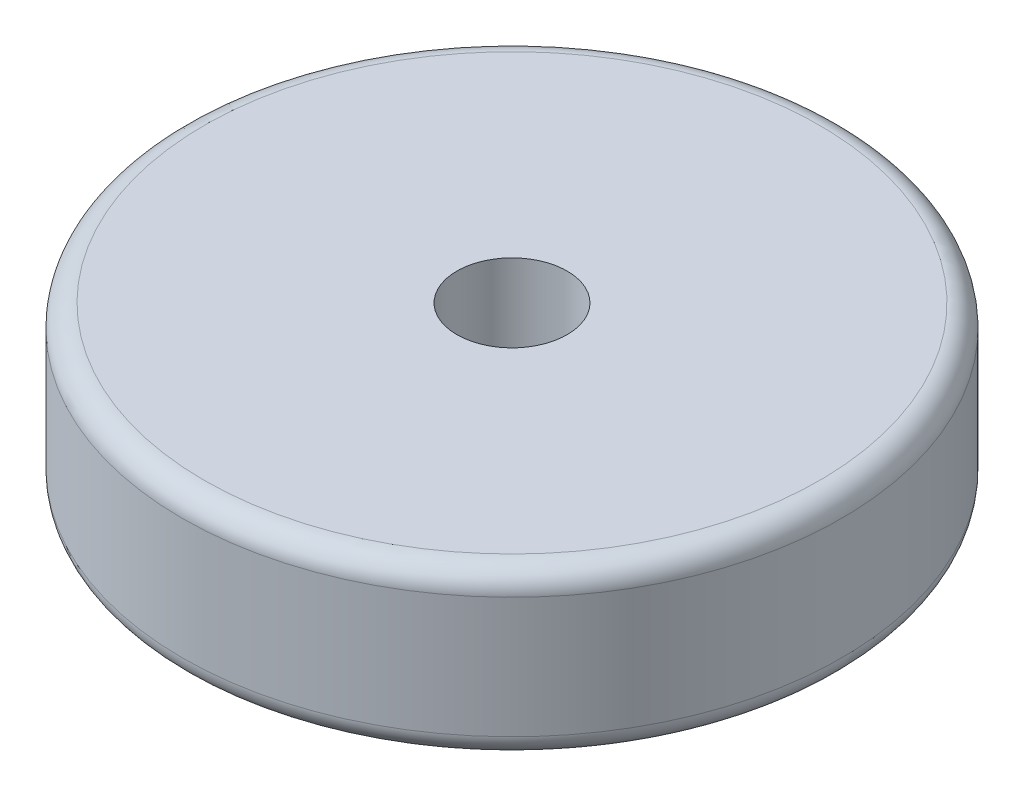
from build123d import *

# Parameters (mm, degrees)
SKETCH1_R           = 76.23527944
BOSS_EXTRUDE1_DEPTH = 38.1
SKETCH2_R           = 12.757911871
CUT_EXTRUDE1_DEPTH  = 38.1
FILLET1_R           = 5.08


with BuildPart() as part:
    # Sketch1 → Boss-Extrude1 (new body)
    with BuildSketch(Plane(origin=(0, 0, 0), x_dir=(1, 0, 0), z_dir=(0, 1, 0))):
        with Locations(Location((0, 0, 0), (0, 0, 90))):
            Circle(SKETCH1_R)
    extrude(amount=BOSS_EXTRUDE1_DEPTH)

    # Sketch2 → Cut-Extrude1 (cut)
    with BuildSketch(Plane(origin=(0, 38.1, 0), x_dir=(1, 0, 0), z_dir=(0, 1, 0))):
        with Locations(Location((0, 0, 0), (0, 0, 270))):
            Circle(SKETCH2_R)
    extrude(amount=-CUT_EXTRUDE1_DEPTH, mode=Mode.SUBTRACT)

    # Fillet1
    fillet1_edges = [part.edges().sort_by_distance(p)[0] for p in [
        (0, 0, 76.23527944),
        (0, 38.1, 76.23527944),
    ]]
    fillet(fillet1_edges, radius=FILLET1_R)


solid = part.part
